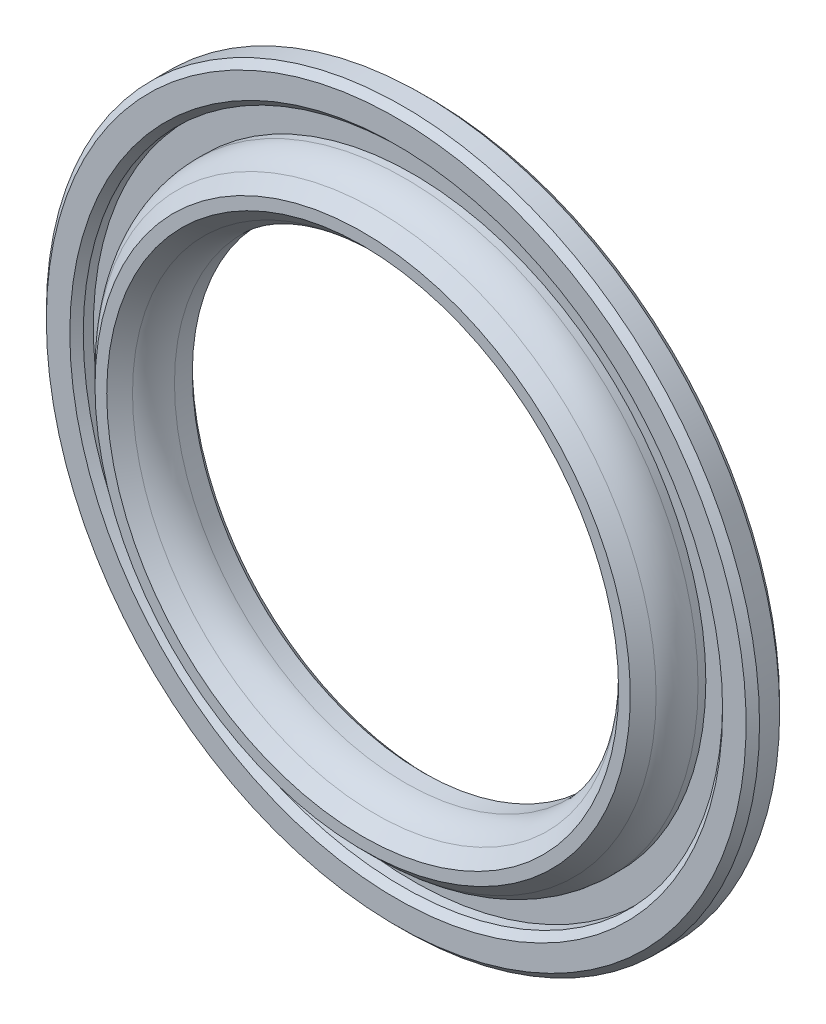
from build123d import *

# Parameters (mm, degrees)
FASE1_SIZE    = 0.8
FASE2_SIZE    = 3
VERRUNDUNG1_R = 5


with BuildPart() as part:
    # Skizze3 → Rotation1 (revolve)
    with BuildSketch(Plane(origin=(0, 0, 0), x_dir=(0, 0, -1), z_dir=(1, 0, 0)), mode=Mode.PRIVATE) as rotation1_sk:
        Polygon((0, 27.5), (0, 34.9), (6, 34.9), (6, 38.1), (4, 38.1), (4, 42.5), (8, 42.5), (8, 27.5), align=None)
    revolve(rotation1_sk.sketch.rotate(Axis((0, 0, 28.082191781), (0, 0, -1)), 90), axis=Axis((0, 0, 28.082191781), (0, 0, -1)))

    # Fase1
    fase1_edges = [part.edges().sort_by_distance(p)[0] for p in [
        (-27.5, 0, -8),
        (-42.5, 0, -8),
        (-42.5, 0, -4),
        (-38.1, 0, -4),
    ]]
    chamfer(fase1_edges, length=FASE1_SIZE)

    # Fase2
    fase2_edges = [part.edges().sort_by_distance(p)[0] for p in [
        (-27.5, 0, 0),
        (-34.9, 0, 0),
    ]]
    chamfer(fase2_edges, length=FASE2_SIZE)

    # Verrundung1
    verrundung1_edges = [part.edges().sort_by_distance(p)[0] for p in [
        (-34.9, 0, -3),
        (-27.5, 0, -3),
    ]]
    fillet(verrundung1_edges, radius=VERRUNDUNG1_R)


solid = part.part
